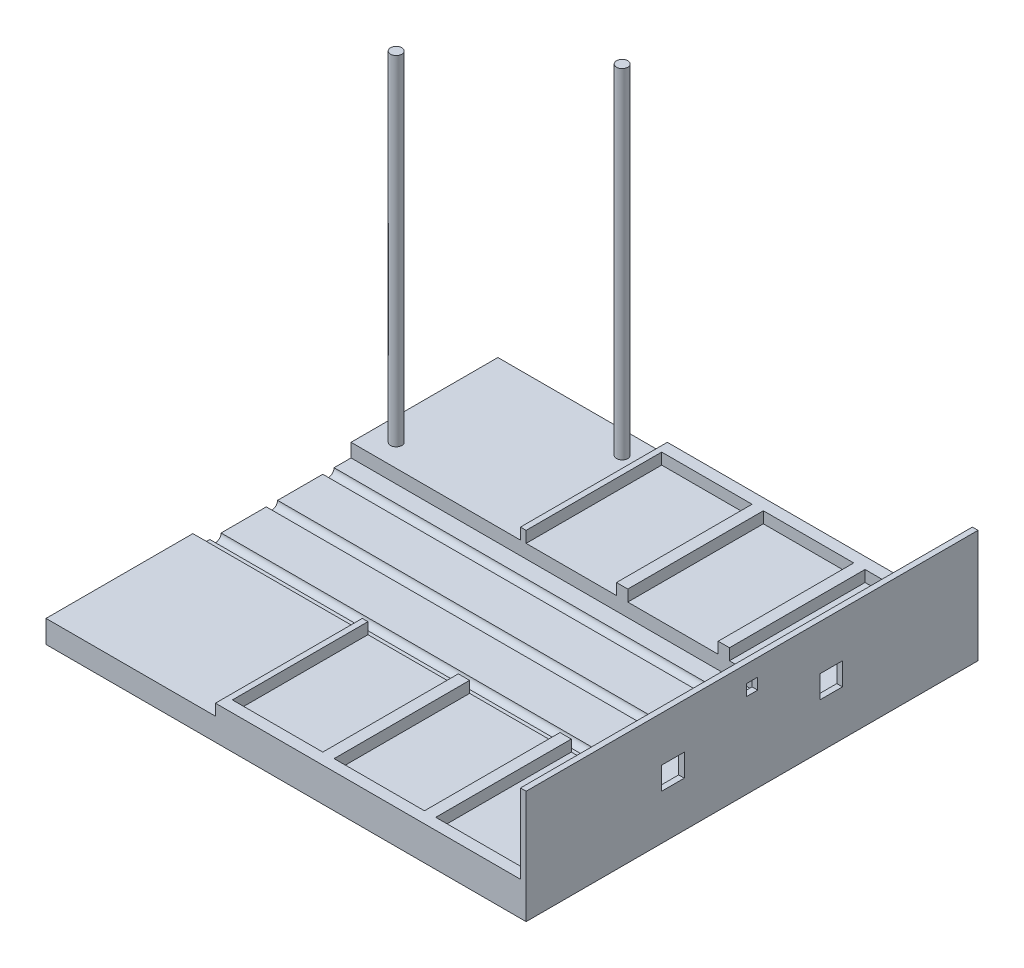
from build123d import *

# Parameters (mm, degrees)
PARKING_DEPTH       = 10
PARKINGS_COUNT      = 3
PARKINGS_PITCH      = 90
RIGHTWALL_DEPTH     = 5
LASERHOLE_REACH     = 351.321
SKETCH2_W           = 20
SKETCH2_H           = 20
SKETCH5_W           = 420
SKETCH5_H           = 130
PARKINGBOTTOM_DEPTH = 20
CARTBOTTOM_DEPTH    = 425
SKETCH9_R           = 5
THREADEDROD_DEPTH   = 300


with BuildPart() as part:
    # SingleLot → Parking (new body)
    with BuildSketch(Plane(origin=(0, 0, 0), x_dir=(1, 0, 0), z_dir=(0, 1, 0))):
        Polygon((5, 70), (0, 70), (0, 200), (90, 200), (90, 70), (85, 70), (85, 190), (5, 190), align=None)
    parking = extrude(amount=PARKING_DEPTH)

    # Parkings: Parking ×3
    with Locations(*[(i * PARKINGS_PITCH, 0, 0) for i in range(1, PARKINGS_COUNT)]):
        add(parking)

    # Wall → RightWall (add)
    with BuildSketch(Plane(origin=(270, 0, 0), x_dir=(0, 0, -1), z_dir=(1, 0, 0))):
        Polygon((0, 65), (0, 80), (200, 80), (200, 0), (200, -20), (0, -20), (0, 0), (0, 55), (5, 55), (5, 65), align=None)
    extrude(amount=RIGHTWALL_DEPTH)

    # Sketch2 → LaserHole (cut, up to next)
    with BuildSketch(Plane(origin=(275, 0, 0), x_dir=(0, 0, -1), z_dir=(1, 0, 0)), mode=Mode.PRIVATE) as laserhole_sk1:
        with Locations((70, 30)):
            Rectangle(SKETCH2_W, SKETCH2_H)
    laserhole_tool1 = extrude(laserhole_sk1.sketch, amount=-LASERHOLE_REACH, mode=Mode.PRIVATE) & part.part
    add(laserhole_tool1.solids().sort_by_distance((275, 30, -70))[0], mode=Mode.SUBTRACT)

    # Sketch5 → ParkingBottom (add)
    with BuildSketch(Plane.XZ):
        with Locations((60, -135)):
            Rectangle(SKETCH5_W, SKETCH5_H)
    extrude(amount=PARKINGBOTTOM_DEPTH)

    # Sketch8 → CartBottom (add)
    with BuildSketch(Plane.ZY.offset(150)):
        with BuildLine():
            Line((-70, -20), (0, -20))
            Line((0, -20), (0, -17))
            ThreePointArc((0, -17), (-3.535533906, -15.535533906), (-5, -12))
            Line((-5, -12), (-45, -12))
            ThreePointArc((-45, -12), (-50, -17), (-55, -12))
            Line((-55, -12), (-70, -12))
            Line((-70, -12), (-70, -20))
        make_face()
    extrude(amount=-CARTBOTTOM_DEPTH)

    # Mirror8: part across plane


with BuildPart() as part_1:
    add(part.part)
    add(part.part.mirror(Plane.XY))

    # Sketch9 → ThreadedRod (add)
    with BuildSketch(Plane(origin=(0, 0, 0), x_dir=(1, 0, 0), z_dir=(0, 1, 0))):
        with Locations(Location((-130, 90, 0), (0, 0, 270))):
            Circle(SKETCH9_R)
        with Locations(Location((-20, 180, 0), (0, 0, 270))):
            Circle(SKETCH9_R)
    extrude(amount=THREADEDROD_DEPTH)


solid = part_1.part
